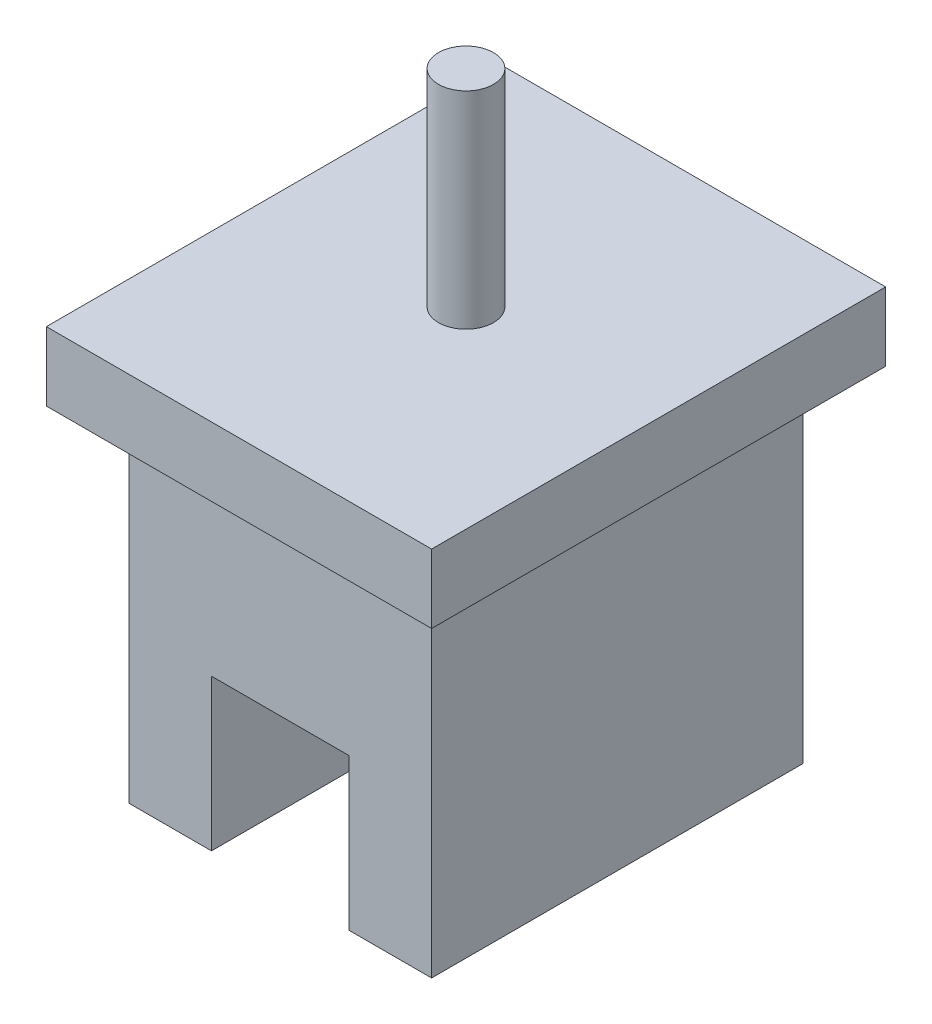
from build123d import *

# Parameters (mm, degrees)
SKETCH1_W               = 28
SKETCH1_H               = 33
FLANGE_DEPTH            = 5
NECK_START              = -14
SKETCH2_W               = 22
SKETCH2_H               = 27
NECK_DEPTH              = 14
PRONGS_START            = -25
SKETCH3_W               = 22
SKETCH3_H               = 27
PRONGS_DEPTH            = 11
SENSING_SLOT_DEPTH      = 34.064331235
SENSING_SLOT_DEPTH_BACK = 34.064331235
SKETCH4_W               = 10
SKETCH4_H               = 12
CABLE_STUB_START        = 5
SKETCH5_R               = 2
CABLE_STUB_DEPTH        = 15


with BuildPart() as part:
    # Sketch1 → Flange (new body)
    with BuildSketch(Plane(origin=(0, 0, 0), x_dir=(1, 0, 0), z_dir=(0, 1, 0))):
        Rectangle(SKETCH1_W, SKETCH1_H)
    extrude(amount=FLANGE_DEPTH)

    # Sketch2 → Neck (add)
    with BuildSketch(Plane(origin=(0, 0, 0), x_dir=(1, 0, 0), z_dir=(0, 1, 0)).offset(NECK_START)):
        Rectangle(SKETCH2_W, SKETCH2_H)
    extrude(amount=NECK_DEPTH)

    # Sketch3 → Prongs (add)
    with BuildSketch(Plane(origin=(0, 0, 0), x_dir=(1, 0, 0), z_dir=(0, 1, 0)).offset(PRONGS_START)):
        Rectangle(SKETCH3_W, SKETCH3_H)
    extrude(amount=PRONGS_DEPTH)

    # Sketch4 → Sensing_Slot (cut, two sides: drawn at the far end of the back side and taken through both)
    with BuildSketch(Plane.XY.offset(-SENSING_SLOT_DEPTH_BACK)):
        with Locations((0, -20)):
            Rectangle(SKETCH4_W, SKETCH4_H)
    extrude(amount=SENSING_SLOT_DEPTH + SENSING_SLOT_DEPTH_BACK, mode=Mode.SUBTRACT)

    # Sketch5 → Cable_Stub (add)
    with BuildSketch(Plane(origin=(0, 0, 0), x_dir=(1, 0, 0), z_dir=(0, 1, 0)).offset(CABLE_STUB_START)):
        with Locations(Location((0, 0, 0), (0, 0, 270))):
            Circle(SKETCH5_R)
    extrude(amount=CABLE_STUB_DEPTH)


solid = part.part
